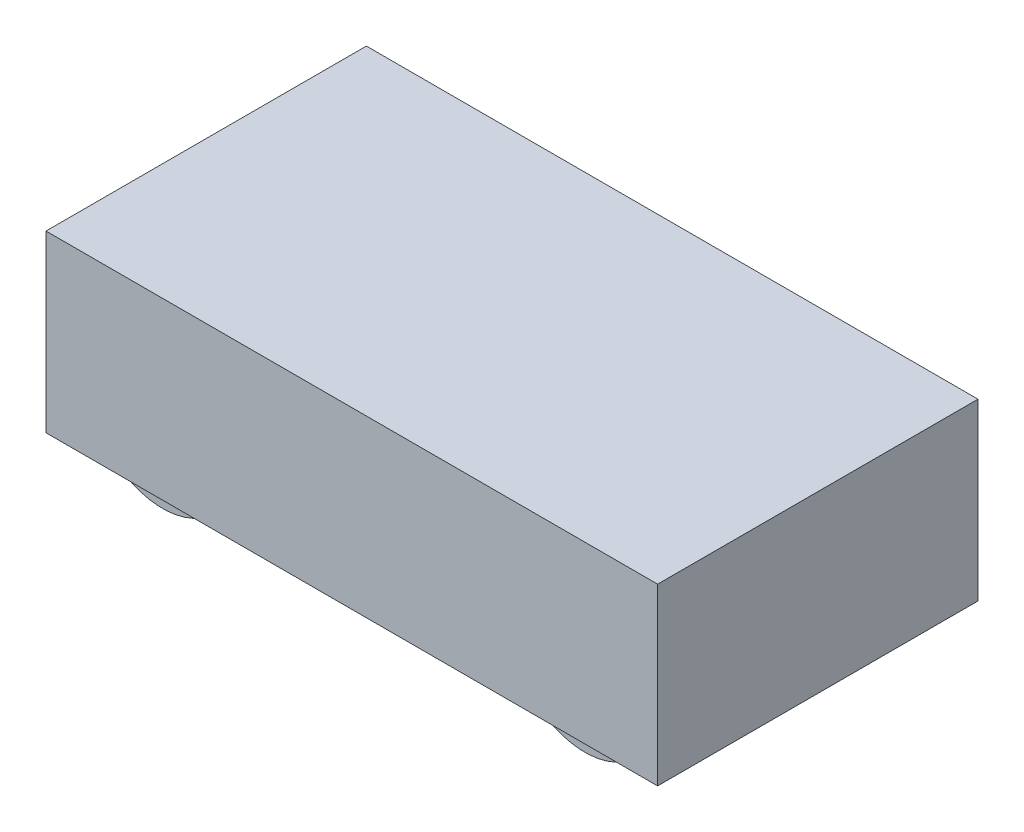
from build123d import *

# Parameters (mm, degrees)
CHASIS_W                = 533.4
CHASIS_H                = 279.4
BOSS_EXTRUDE1_DEPTH     = 152.4
SKETCH3_W               = 63.5
SKETCH3_H               = 50.8
MIRROR2_COPY_1_SKETCH_W = 63.5
MIRROR2_COPY_1_SKETCH_H = 50.8
SKETCH4_W               = 101.6
SKETCH4_H               = 12.7
CUT_EXTRUDE1_DEPTH      = 241.3


with BuildPart() as part:
    # Chasis → Boss-Extrude1 (new body)
    with BuildSketch(Plane(origin=(0, 0, 0), x_dir=(1, 0, 0), z_dir=(0, 1, 0))):
        Rectangle(CHASIS_W, CHASIS_H)
    extrude(amount=BOSS_EXTRUDE1_DEPTH)

    # Sketch3 → Revolve2 (revolve)
    with BuildSketch(Plane(origin=(0, 38.1, 0), x_dir=(-1, 0, 0), z_dir=(0, -1, 0))):
        with Locations((215.9, -95.25)):
            Rectangle(SKETCH3_W, SKETCH3_H)
    revolve2 = revolve(axis=Axis((-184.15, 38.1, 69.85), (0, 0, 1)))

    # Mirror1: Revolve2 across plane
    add(revolve2.mirror(Plane.XY))

    # Mirror2: Revolve2 across plane
    add(revolve2.mirror(Plane(origin=(0, 0, 0), x_dir=(0, 0, 1), z_dir=(1, 0, 0))))

    # Mirror2 copy 1 sketch → Mirror2 copy 1 (revolve)
    with BuildSketch(Plane.XZ.offset(-38.1)):
        with Locations((215.9, -95.25)):
            Rectangle(MIRROR2_COPY_1_SKETCH_W, MIRROR2_COPY_1_SKETCH_H)
    revolve(axis=Axis((184.15, 38.1, -69.85), (0, 0, -1)))

    # Sketch4 → Cut-Extrude1 (cut)
    with BuildSketch(Plane.ZY.offset(266.7)):
        with Locations((0, 44.45)):
            Rectangle(SKETCH4_W, SKETCH4_H)
    extrude(amount=-CUT_EXTRUDE1_DEPTH, mode=Mode.SUBTRACT)


solid = part.part
